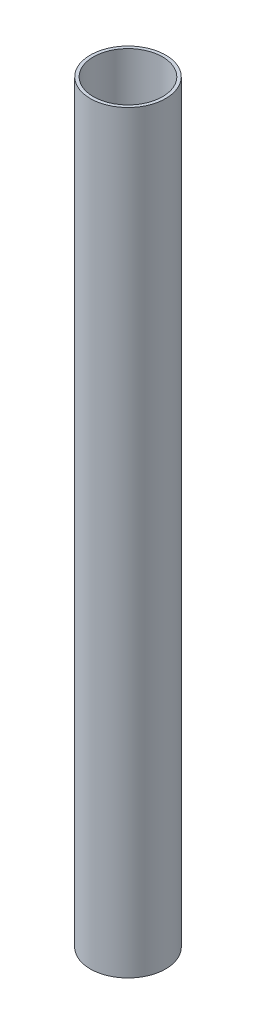
from build123d import *

# Parameters (mm, degrees)
VARREDURA1_PROFILE_R = 30
CASCA1_T             = -2.5


with BuildPart() as part:
    # Varredura1: sweep along a curve in space
    with BuildLine() as varredura1_path:
        Line((0, 0, 0), (0, 600, 0))
    # Varredura1 profile (on start of the path) → Varredura1 (sweep)
    with BuildSketch(Plane.ZX):
        Circle(VARREDURA1_PROFILE_R)
    sweep(path=varredura1_path.line)

    # Casca1
    casca1_openings = [part.faces().sort_by_distance(p)[0] for p in [
        (0, 600, 0),
        (0, 0, 0),
    ]]
    offset(amount=CASCA1_T, openings=casca1_openings, kind=Kind.INTERSECTION)


solid = part.part
